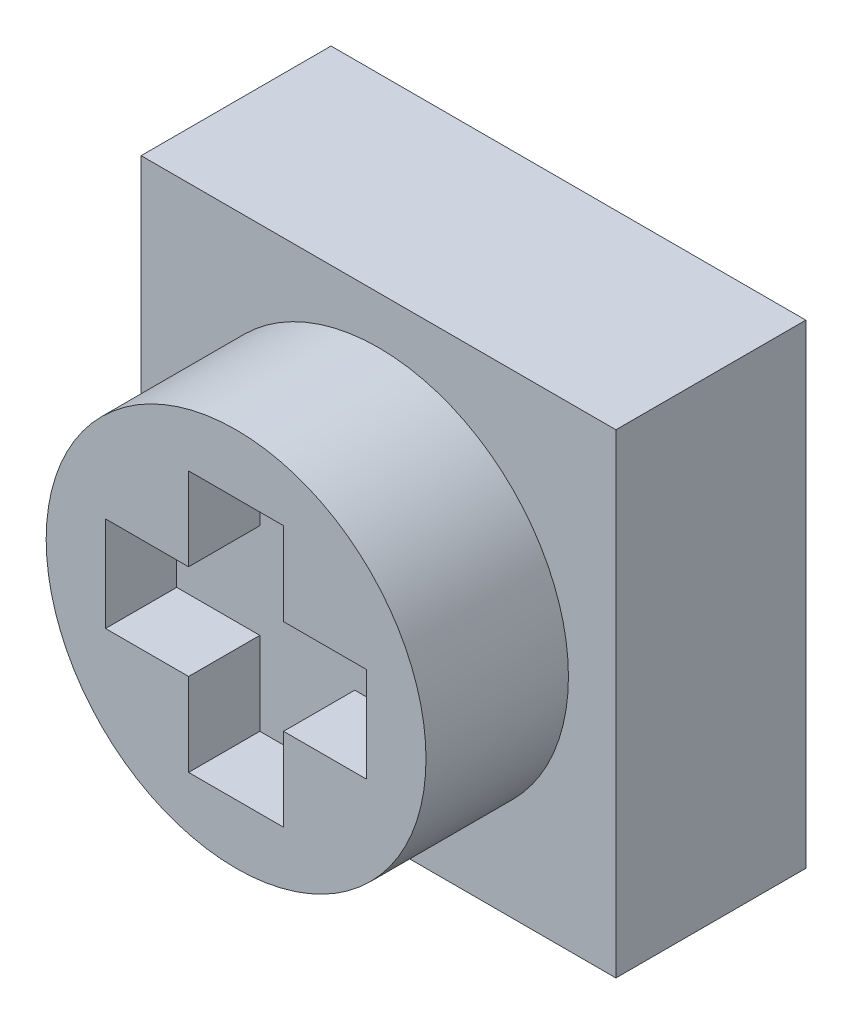
from build123d import *

# Parameters (mm, degrees)
SKETCH1_W           = 10
SKETCH1_H           = 10
BOSS_EXTRUDE1_DEPTH = 4
SKETCH2_R           = 4
BOSS_EXTRUDE2_DEPTH = 3
CUT_EXTRUDE1_DEPTH  = 1.5


with BuildPart() as part:
    # Sketch1 → Boss-Extrude1 (new body)
    with BuildSketch(Plane.XY):
        with Locations((5, -5)):
            Rectangle(SKETCH1_W, SKETCH1_H)
    extrude(amount=BOSS_EXTRUDE1_DEPTH)

    # Sketch2 → Boss-Extrude2 (add)
    with BuildSketch(Plane.XY.offset(4)):
        with Locations((5, -5)):
            Circle(SKETCH2_R)
    extrude(amount=BOSS_EXTRUDE2_DEPTH)

    # Sketch3 → Cut-Extrude1 (cut)
    with BuildSketch(Plane.XY.offset(7)):
        Polygon((4, -4), (4, -2.25), (6, -2.25), (6, -4), (7.75, -4), (7.75, -6), (6, -6), (6, -7.75), (4, -7.75), (4, -6), (2.25, -6), (2.25, -4), align=None)
    extrude(amount=-CUT_EXTRUDE1_DEPTH, mode=Mode.SUBTRACT)


solid = part.part
